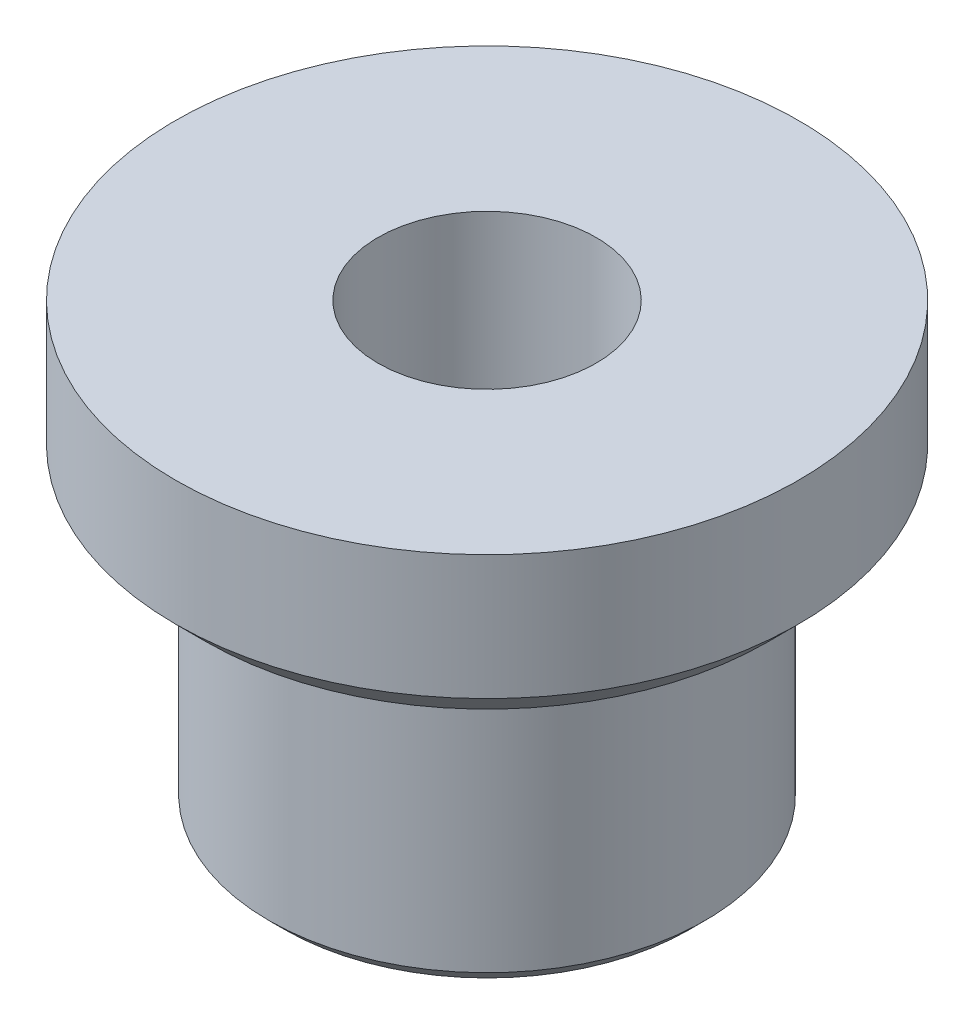
from build123d import *

# Parameters (mm, degrees)
SKETCH3_R           = 10
SKETCH3_R_2         = 7
BASE_DEPTH          = 5
SKETCH3_2_R         = 7
BOSS_EXTRUDE4_DEPTH = 14.24
SKETCH4_R           = 3.3
SKETCH4_R_2         = 1.65
CUT_EXTRUDE4_DEPTH  = 5
CUT_EXTRUDE5_START  = -9.99
SKETCH4_3_R         = 5
SKETCH4_3_R_2       = 3.3
SKETCH4_3_R_3       = 1.65
CUT_EXTRUDE5_DEPTH  = 4.25
SKETCH4_4_R         = 1.65
CUT_EXTRUDE6_DEPTH  = 21.069319869
F_2_MOVE_FACE1_BY   = 0.2
F_2_MOVE_FACE1_2_BY = 0.2
F_2_MOVE_FACE1_3_BY = 0.2
F_2_MOVE_FACE1_4_BY = 0.2
CHAMFER1_SIZE       = 0.5
CHAMFER2_SIZE       = 1


with BuildPart() as part:
    # Sketch3 → Base (new body)
    with BuildSketch(Plane(origin=(0, 0, 0), x_dir=(1, 0, 0), z_dir=(0, 1, 0))):
        with Locations(Location((0, 0, 0), (0, 0, 270))):
            Circle(SKETCH3_R)
        with Locations(Location((0, 0, 0), (0, 0, 270))):
            Circle(SKETCH3_R_2, mode=Mode.SUBTRACT)
    extrude(amount=-BASE_DEPTH)

    # Sketch3<2> → Boss-Extrude4 (add)
    with BuildSketch(Plane(origin=(0, 0, 0), x_dir=(1, 0, 0), z_dir=(0, 1, 0))):
        with Locations(Location((0, 0, 0), (0, 0, 270))):
            Circle(SKETCH3_2_R)
    extrude(amount=-BOSS_EXTRUDE4_DEPTH)

    # Sketch4 → Cut-Extrude4 (cut)
    with BuildSketch(Plane(origin=(0, 0, 0), x_dir=(1, 0, 0), z_dir=(0, 1, 0))):
        with Locations(Location((0, 0, 0), (0, 0, 270))):
            Circle(SKETCH4_R)
        with Locations(Location((0, 0, 0), (0, 0, 270))):
            Circle(SKETCH4_R_2, mode=Mode.SUBTRACT)
    extrude(amount=-CUT_EXTRUDE4_DEPTH, mode=Mode.SUBTRACT)

    # Sketch4<3> → Cut-Extrude5 (cut)
    # profile 1 of 3: a face of its own
    with BuildSketch(Plane(origin=(0, 0, 0), x_dir=(1, 0, 0), z_dir=(0, 1, 0)).offset(CUT_EXTRUDE5_START)):
        with Locations(Location((0, 0, 0), (0, 0, 270))):
            Circle(SKETCH4_3_R)
        with Locations(Location((0, 0, 0), (0, 0, 270))):
            Circle(SKETCH4_3_R_2, mode=Mode.SUBTRACT)
    # profile 2 of 3: a face of its own
    with BuildSketch(Plane(origin=(0, 0, 0), x_dir=(1, 0, 0), z_dir=(0, 1, 0)).offset(CUT_EXTRUDE5_START)):
        with Locations(Location((0, 0, 0), (0, 0, 270))):
            Circle(SKETCH4_3_R_2)
        with Locations(Location((0, 0, 0), (0, 0, 270))):
            Circle(SKETCH4_3_R_3, mode=Mode.SUBTRACT)
    # profile 3 of 3: a face of its own
    with BuildSketch(Plane(origin=(0, 0, 0), x_dir=(1, 0, 0), z_dir=(0, 1, 0)).offset(CUT_EXTRUDE5_START)):
        with Locations(Location((0, 0, 0), (0, 0, 270))):
            Circle(SKETCH4_3_R_3)
    extrude(amount=-CUT_EXTRUDE5_DEPTH, mode=Mode.SUBTRACT)

    # Sketch4<4> → Cut-Extrude6 (cut, through all)
    with BuildSketch(Plane(origin=(0, 0, 0), x_dir=(1, 0, 0), z_dir=(0, 1, 0))):
        with Locations(Location((0, 0, 0), (0, 0, 270))):
            Circle(SKETCH4_4_R)
    extrude(amount=-CUT_EXTRUDE6_DEPTH, mode=Mode.SUBTRACT)

    # .2 Move Face1: a curved face moved inward by 0.2
    add(Solid.thicken(part.faces().sort_by_distance((0, -12.115, -5))[0], -F_2_MOVE_FACE1_BY), mode=Mode.SUBTRACT)

    # 2 Move Face1 2: a curved face moved inward by 0.2
    add(Solid.thicken(part.faces().sort_by_distance((0, -7.495, -1.65))[0], -F_2_MOVE_FACE1_2_BY), mode=Mode.SUBTRACT)

    # 2 Move Face1 3: a face moved inward by 0.2
    extrude(part.faces().sort_by_distance((0, -5, 2.64))[0], amount=F_2_MOVE_FACE1_3_BY, dir=(0, -1, 0), mode=Mode.SUBTRACT)

    # 2 Move Face1 4: a curved face moved inward by 0.2
    add(Solid.thicken(part.faces().sort_by_distance((0, -2.5, -3.3))[0], -F_2_MOVE_FACE1_4_BY), mode=Mode.SUBTRACT)

    # Chamfer1
    chamfer1_edges = [part.edges().sort_by_distance(p)[0] for p in [
        (0, -14.24, -7),
        (0, -14.24, -5.2),
    ]]
    chamfer(chamfer1_edges, length=CHAMFER1_SIZE)

    # Chamfer2
    chamfer2_edges = [part.edges().sort_by_distance(p)[0] for p in [
        (0, -5, -10),
    ]]
    chamfer(chamfer2_edges, length=CHAMFER2_SIZE)


solid = part.part
